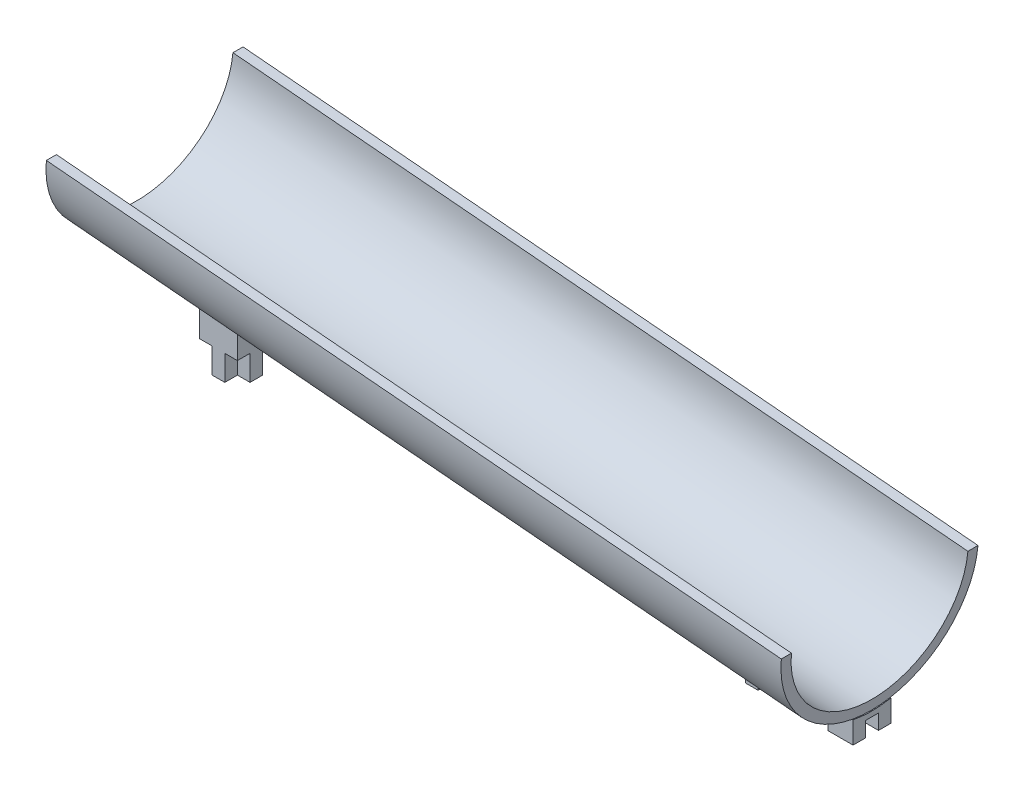
from build123d import *

# Parameters (mm, degrees)
SWEEP2_PROFILE_R         = 39
CUT_EXTRUDE5_DEPTH       = 400
BOSS_EXTRUDE2_REACH      = 250.512
BOSS_EXTRUDE2_END_RADIUS = 39
SKETCH30_W               = 15
SKETCH30_H               = 15
SKETCH31_W               = 5
SKETCH31_H               = 5
CUT_EXTRUDE6_DEPTH       = 10
BOSS_EXTRUDE3_REACH      = 250.512
BOSS_EXTRUDE3_END_RADIUS = 39
CUT_EXTRUDE7_DEPTH       = 6


with BuildPart() as part:
    # Sweep2: sweep along a path in Sketch17
    with BuildLine(Plane.XY) as sweep2_path:
        Line((-56.942235333, 25.5), (234.524098388, 0))
    # Sweep2 profile (on start of the path) → Sweep2 (sweep)
    with BuildSketch(Plane(origin=(-56.942235333, 25.5, 0), x_dir=(0.08715574274765121, 0.9961946980917462, 0), z_dir=(0.9961946980917462, -0.08715574274765121, 0))):
        Circle(SWEEP2_PROFILE_R)
    sweep(path=sweep2_path.line)

    # Sketch25 → Cut-Extrude5 (cut)
    with BuildSketch(Plane(origin=(232.742624374, -20.362341152, 0), x_dir=(0, 0, -1), z_dir=(0.9961946980917462, -0.08715574274765125, 0))):
        with BuildLine():
            Line((40.377384308, 20.440121987), (40.377384308, 67.184416815))
            Line((40.377384308, 67.184416815), (-52.333834244, 67.184416815))
            Line((-52.333834244, 67.184416815), (-52.333834244, 20.440121987))
            Line((-52.333834244, 20.440121987), (-35, 20.440121987))
            ThreePointArc((-35, 20.440121987), (0, -14.559878013), (35, 20.440121987))
            Line((35, 20.440121987), (40.377384308, 20.440121987))
        make_face()
    extrude(amount=-CUT_EXTRUDE5_DEPTH, mode=Mode.SUBTRACT)

    # Boss-Extrude2: up to this cylinder (the profile starts outside it)
    boss_extrude2_end = Plane(origin=(90.766179518, 12.577188193, 0), z_dir=(0.9961946980917462, -0.08715574274765124, 0)) * Cylinder(BOSS_EXTRUDE2_END_RADIUS, 790.685640756, mode=Mode.PRIVATE)
    # Sketch30 → Boss-Extrude2 (add, up to the surface)
    with BuildSketch(Plane(origin=(0, -46.859203829, 0), x_dir=(1, 0, 0), z_dir=(0, 1, 0)), mode=Mode.PRIVATE) as boss_extrude2_sk1:
        with Locations((-20.166997814, 0)):
            Rectangle(SKETCH30_W, SKETCH30_H)
    boss_extrude2_tool1 = extrude(boss_extrude2_sk1.sketch, amount=BOSS_EXTRUDE2_REACH, mode=Mode.PRIVATE) - boss_extrude2_end
    add(boss_extrude2_tool1.solids().sort_by_distance((-20.166998, -46.859204, 0))[0])
    # Sketch30 → Boss-Extrude2 (add, up to the surface)
    with BuildSketch(Plane(origin=(0, -46.859203829, 0), x_dir=(1, 0, 0), z_dir=(0, 1, 0)), mode=Mode.PRIVATE) as boss_extrude2_sk2:
        with Locations((191.299335906, 0)):
            Rectangle(SKETCH30_W, SKETCH30_H)
    boss_extrude2_tool2 = extrude(boss_extrude2_sk2.sketch, amount=BOSS_EXTRUDE2_REACH, mode=Mode.PRIVATE) - boss_extrude2_end
    add(boss_extrude2_tool2.solids().sort_by_distance((191.299336, -46.859204, 0))[0])

    # Sketch31 → Cut-Extrude6 (cut)
    with BuildSketch(Plane.XZ.offset(46.859203829)):
        with Locations((-25.166997814, 5)):
            Rectangle(SKETCH31_W, SKETCH31_H)
        with Locations((-15.166997814, 5)):
            Rectangle(SKETCH31_W, SKETCH31_H)
        with Locations((-15.166997814, -5)):
            Rectangle(SKETCH31_W, SKETCH31_H)
        with Locations((-25.166997814, -5)):
            Rectangle(SKETCH31_W, SKETCH31_H)
        with Locations((186.299335906, -5)):
            Rectangle(SKETCH31_W, SKETCH31_H)
        with Locations((196.299335906, -5)):
            Rectangle(SKETCH31_W, SKETCH31_H)
        with Locations((196.299335906, 5)):
            Rectangle(SKETCH31_W, SKETCH31_H)
        with Locations((186.299335906, 5)):
            Rectangle(SKETCH31_W, SKETCH31_H)
    extrude(amount=-CUT_EXTRUDE6_DEPTH, mode=Mode.SUBTRACT)

    # Boss-Extrude3: up to this cylinder (the profile starts outside it)
    boss_extrude3_end = Plane(origin=(230.603306914, 0.343024806, 0), z_dir=(0.9961946980917462, -0.08715574274765124, 0)) * Cylinder(BOSS_EXTRUDE3_END_RADIUS, 580.024, mode=Mode.PRIVATE)
    # Sketch38 → Boss-Extrude3 (add, up to the surface)
    with BuildSketch(Plane(origin=(0, -46.859203829, 0), x_dir=(1, 0, 0), z_dir=(0, 1, 0)), mode=Mode.PRIVATE) as boss_extrude3_sk1:
        Polygon((231.473647391, 0), (231.473647391, -7.5), (221.473647391, -7.5), (221.473647391, 7.5), (231.473647391, 7.5), align=None)
    boss_extrude3_tool1 = extrude(boss_extrude3_sk1.sketch, amount=BOSS_EXTRUDE3_REACH, mode=Mode.PRIVATE) - boss_extrude3_end
    add(boss_extrude3_tool1.solids().sort_by_distance((226.473647, -46.859204, 0))[0])

    # Sketch39 → Cut-Extrude7 (cut)
    with BuildSketch(Plane.XZ.offset(46.859203829)):
        Polygon((231.473647391, 0), (231.473647391, 2.6), (221.473647391, 2.6), (221.473647391, -2.6), (231.473647391, -2.6), align=None)
    extrude(amount=-CUT_EXTRUDE7_DEPTH, mode=Mode.SUBTRACT)


solid = part.part
